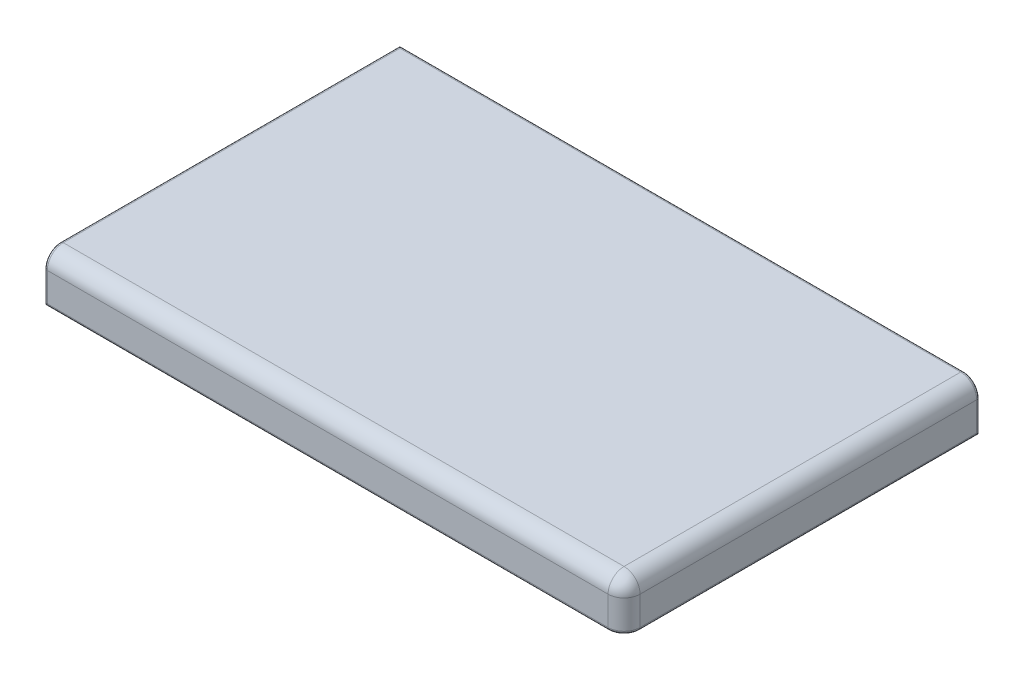
from build123d import *

# Parameters (mm, degrees)
SKETCH2_W           = 1811.005901602
SKETCH2_H           = 1111.13195988
BOSS_EXTRUDE1_DEPTH = 150
FILLET1_R           = 50
FILLET2_R           = 50
FILLET3_R           = 10


with BuildPart() as part:
    # Sketch2 → Boss-Extrude1 (new body)
    with BuildSketch(Plane(origin=(0, 0, 0), x_dir=(1, 0, 0), z_dir=(0, 1, 0))):
        with Locations((905.502950801, -641.290581232)):
            Rectangle(SKETCH2_W, SKETCH2_H)
    extrude(amount=BOSS_EXTRUDE1_DEPTH)

    # Fillet1
    fillet1_edges = [part.edges().sort_by_distance(p)[0] for p in [
        (1811.005901602, 150, 641.290581232),
    ]]
    fillet(fillet1_edges, radius=FILLET1_R)

    # Fillet2
    fillet2_edges = [part.edges().sort_by_distance(p)[0] for p in [
        (1811.005901602, 50, 1196.856561172),
        (1796.361240661, 135.355339059, 1196.856561172),
        (880.502950801, 150, 1196.856561172),
    ]]
    fillet(fillet2_edges, radius=FILLET2_R)

    # Fillet3
    fillet3_edges = [part.edges().sort_by_distance(p)[0] for p in [
        (1811.005901602, 50, 85.724601292),
        (880.502950801, 150, 85.724601292),
        (1796.361240661, 135.355339059, 85.724601292),
        (0, 50, 1196.856561172),
        (1811.005901602, 0, 616.290581232),
        (1796.361240661, 0, 1182.211900231),
        (0, 135.355339059, 1182.211900231),
        (0, 150, 616.290581232),
        (880.502950801, 0, 1196.856561172),
    ]]
    fillet(fillet3_edges, radius=FILLET3_R)


solid = part.part
